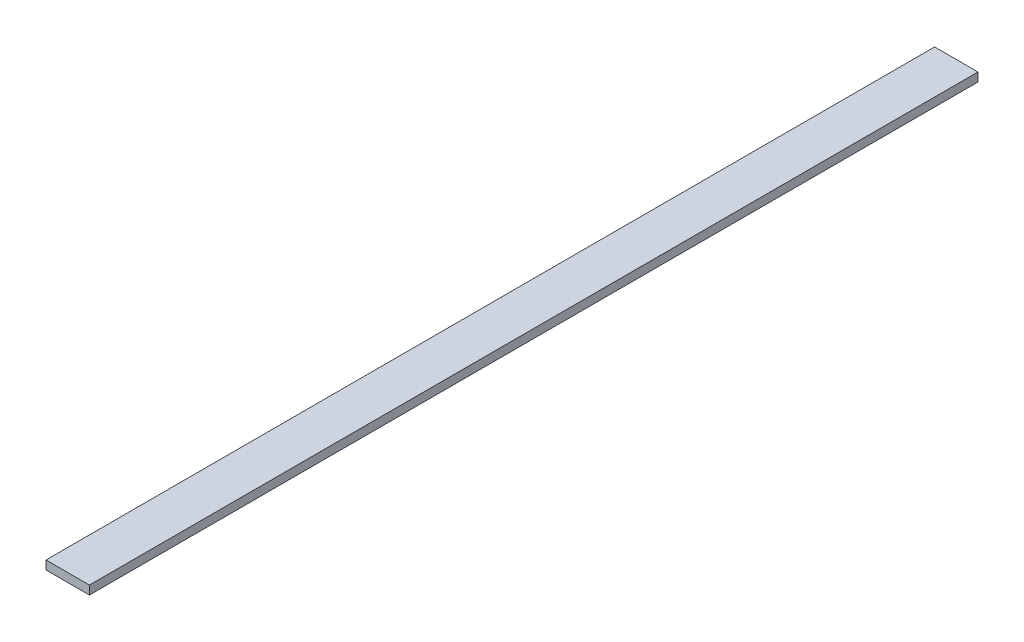
from build123d import *

# Parameters (mm, degrees)
SKETCH1_W           = 20
SKETCH1_H           = 409.575
BOSS_EXTRUDE1_DEPTH = 4


with BuildPart() as part:
    # Sketch1 → Boss-Extrude1 (new body)
    with BuildSketch(Plane(origin=(0, 0, 0), x_dir=(1, 0, 0), z_dir=(0, 1, 0))):
        Rectangle(SKETCH1_W, SKETCH1_H)
    extrude(amount=BOSS_EXTRUDE1_DEPTH)


solid = part.part
